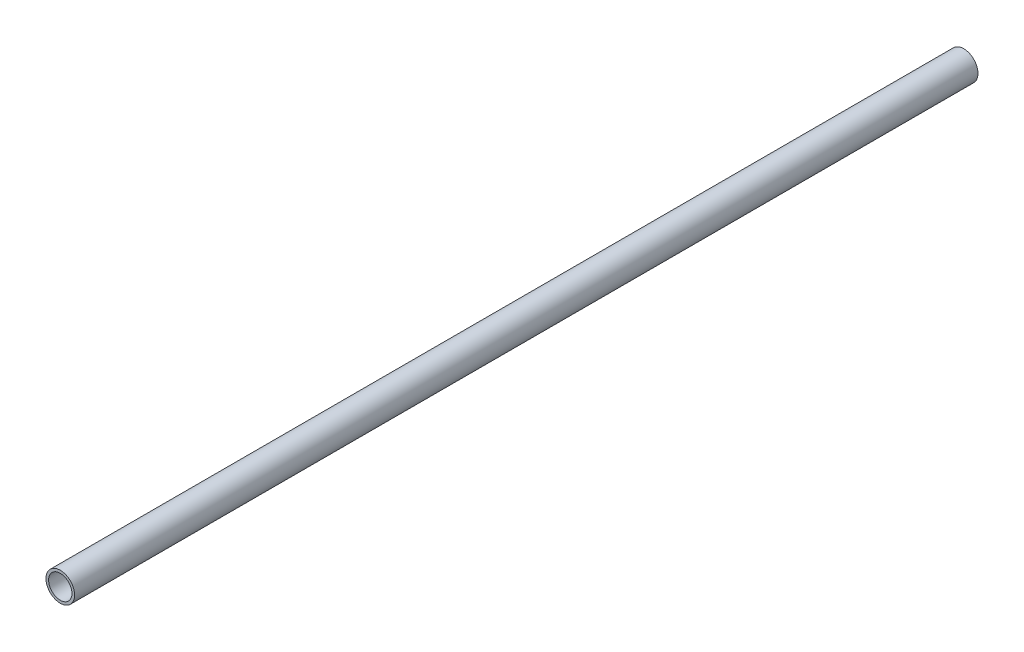
from build123d import *

# Parameters (mm, degrees)
SKETCH1_R           = 14.1
SKETCH1_R_2         = 11.5
BOSS_EXTRUDE1_DEPTH = 445


with BuildPart() as part:
    # Sketch1 → Boss-Extrude1 (new, symmetric)
    with BuildSketch(Plane.XY):
        Circle(SKETCH1_R)
        Circle(SKETCH1_R_2, mode=Mode.SUBTRACT)
    extrude(amount=BOSS_EXTRUDE1_DEPTH, both=True)


solid = part.part
